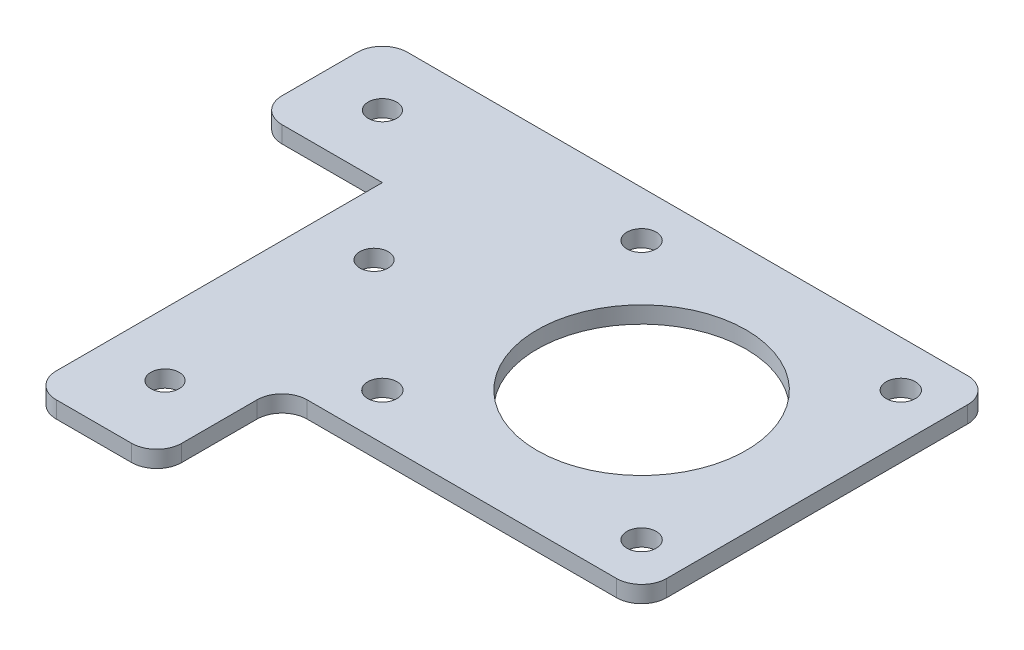
from build123d import *

# Parameters (mm, degrees)
SKETCH_1_R      = 12.5
SKETCH_1_R_2    = 1.75
SKETCH_1_R_3    = 1.7
EXTRUDE_2_DEPTH = 2


with BuildPart() as part:
    # 草图1 → 凸台-拉伸2 (new body)
    with BuildSketch(Plane(origin=(0, 0, 0), x_dir=(1, 0, 0), z_dir=(0, 1, 0))):
        with BuildLine():
            Line((0, 0), (-12, 0))
            ThreePointArc((-12, 0), (-14.121320344, 0.878679656), (-15, 3))
            Line((-15, 3), (-15, 12))
            ThreePointArc((-15, 12), (-14.121320344, 14.121320344), (-12, 15))
            Line((-12, 15), (15, 15))
            Line((15, 15), (55, 15))
            ThreePointArc((55, 15), (57.121320344, 14.121320344), (58, 12))
            Line((58, 12), (58, -24))
            ThreePointArc((58, -24), (57.121320344, -26.121320344), (55, -27))
            Line((55, -27), (18, -27))
            ThreePointArc((18, -27), (15.878679656, -27.878679656), (15, -30))
            Line((15, -30), (15, -39))
            ThreePointArc((15, -39), (14.121320344, -41.121320344), (12, -42))
            Line((12, -42), (3, -42))
            ThreePointArc((3, -42), (0.878679656, -41.121320344), (0, -39))
            Line((0, -39), (0, -32.824659397))
            Line((0, -32.824659397), (0, 0))
        make_face()
        with Locations(Location((37, -6, 0), (0, 0, 270))):
            Circle(SKETCH_1_R, mode=Mode.SUBTRACT)
        with Locations(Location((52.5, -21.5, 0), (0, 0, 270))):
            Circle(SKETCH_1_R_2, mode=Mode.SUBTRACT)
        with Locations(Location((21.5, -21.5, 0), (0, 0, 270))):
            Circle(SKETCH_1_R_2, mode=Mode.SUBTRACT)
        with Locations(Location((21.5, 9.5, 0), (0, 0, 90))):
            Circle(SKETCH_1_R_2, mode=Mode.SUBTRACT)
        with Locations(Location((52.5, 9.5, 0), (0, 0, 90))):
            Circle(SKETCH_1_R_2, mode=Mode.SUBTRACT)
        with Locations(Location((7.5, -8.5, 0), (0, 0, 270))):
            Circle(SKETCH_1_R_3, mode=Mode.SUBTRACT)
        with Locations(Location((7.5, -33.5, 0), (0, 0, 270))):
            Circle(SKETCH_1_R_3, mode=Mode.SUBTRACT)
        with Locations(Location((-7.5, 7.5, 0), (0, 0, 270))):
            Circle(SKETCH_1_R_3, mode=Mode.SUBTRACT)
    extrude(amount=EXTRUDE_2_DEPTH)


solid = part.part
